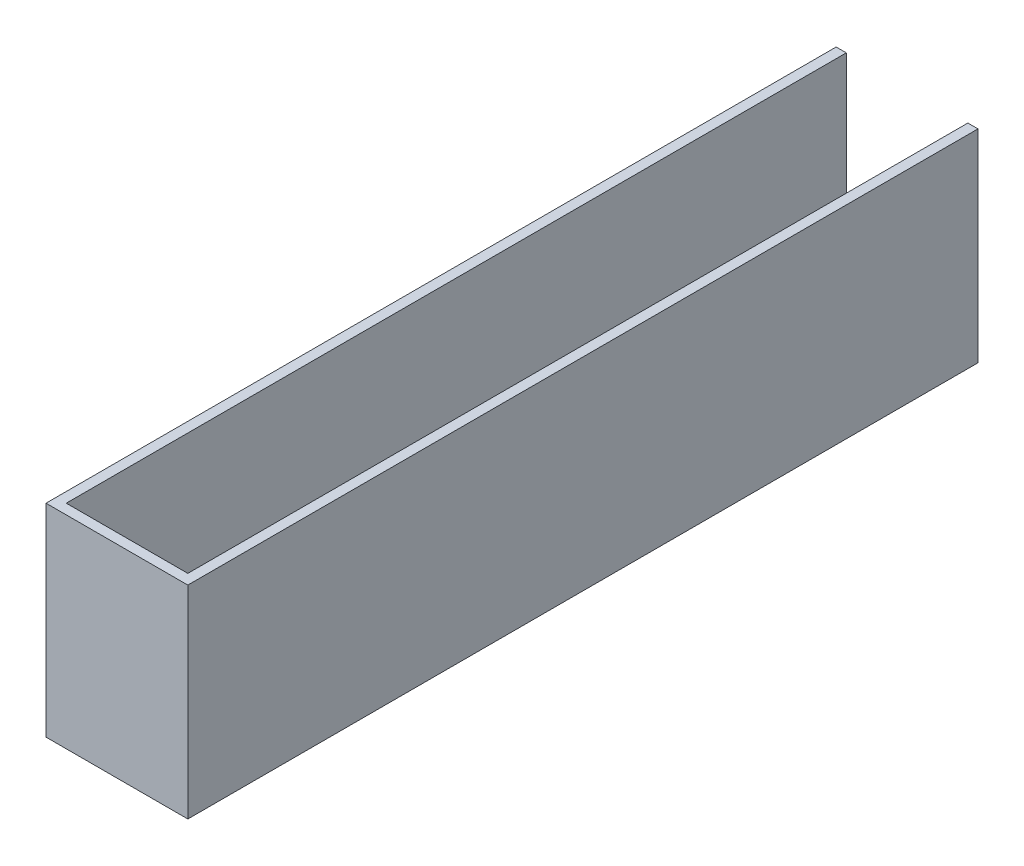
from build123d import *

# Parameters (mm, degrees)
BOSS_EXTRUDE1_DEPTH = 200


with BuildPart() as part:
    # Sketch1 → Boss-Extrude1 (new body)
    with BuildSketch(Plane(origin=(0, 0, 0), x_dir=(1, 0, 0), z_dir=(0, 1, 0))):
        Polygon((0, 0), (0, 780), (-10, 780), (-10, 10), (-130, 10), (-130, 780), (-140, 780), (-140, 0), align=None)
    extrude(amount=BOSS_EXTRUDE1_DEPTH)


solid = part.part
